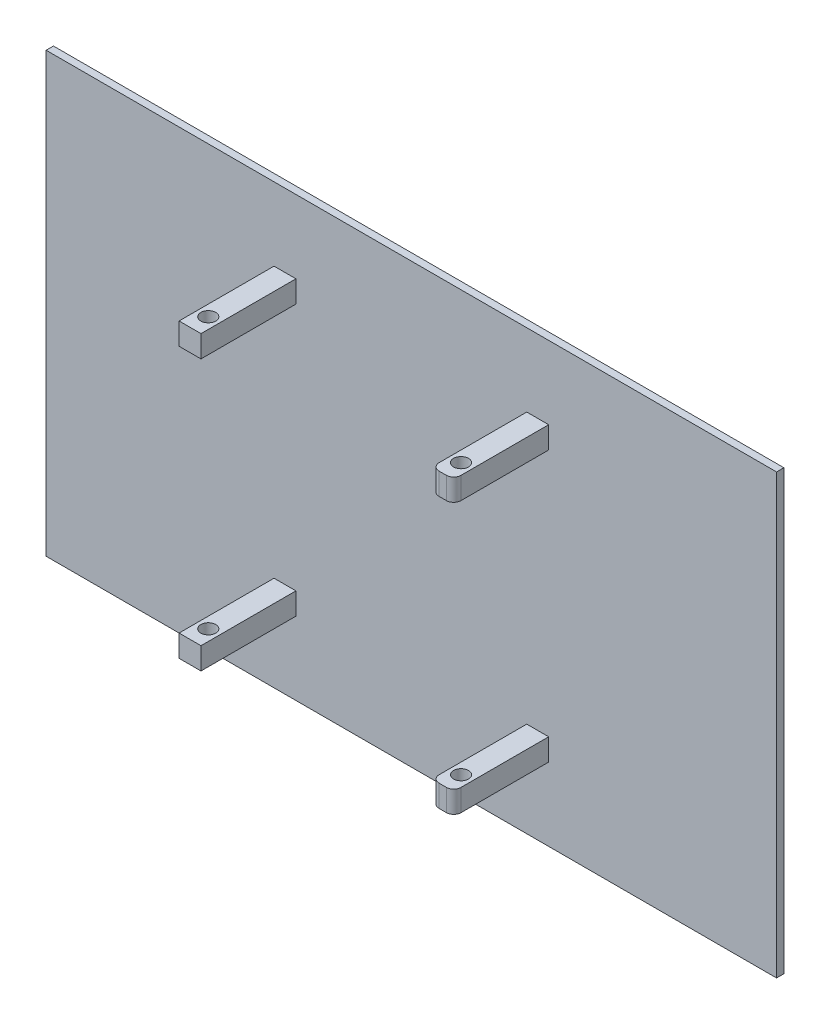
from build123d import *

# Parameters (mm, degrees)
ESBO_O1_W                  = 100
ESBO_O1_H                  = 60
RESSALTO_EXTRUS_O1_DEPTH   = 1
ESBO_O2_W                  = 3
ESBO_O2_H                  = 3
RESSALTO_EXTRUS_O2_DEPTH   = 14
CORTE_EXTRUS_O1_DEPTH      = 73.083285164
CORTE_EXTRUS_O1_DEPTH_BACK = 73.083285164
ESBO_O3_R                  = 1.025
FILETE1_R                  = 1
FILETE2_R                  = 1


with BuildPart() as part:
    # Esboço1 → Ressalto-extrusão1 (new body)
    with BuildSketch(Plane.XY):
        Rectangle(ESBO_O1_W, ESBO_O1_H)
    extrude(amount=RESSALTO_EXTRUS_O1_DEPTH)

    # Esboço2 → Ressalto-extrusão2 (add)
    with BuildSketch(Plane.XY):
        with Locations((17.3, 18.5)):
            Rectangle(ESBO_O2_W, ESBO_O2_H)
        with Locations((17.3, -18.5)):
            Rectangle(ESBO_O2_W, ESBO_O2_H)
        with Locations((-17.3, -18.5)):
            Rectangle(ESBO_O2_W, ESBO_O2_H)
        with Locations((-17.3, 18.5)):
            Rectangle(ESBO_O2_W, ESBO_O2_H)
    extrude(amount=RESSALTO_EXTRUS_O2_DEPTH)

    # Esboço3 → Corte-extrusão1 (cut, two sides: drawn at the far end of the back side and taken through both)
    with BuildSketch(Plane(origin=(0, -20, 0), x_dir=(-1, 0, 0), z_dir=(0, -1, 0)).offset(-CORTE_EXTRUS_O1_DEPTH_BACK)):
        with Locations(Location((-17.3, -11.5, 0), (0, 0, 90))):
            Circle(ESBO_O3_R)
        with Locations(Location((17.3, -11.5, 0), (0, 0, 90))):
            Circle(ESBO_O3_R)
    extrude(amount=CORTE_EXTRUS_O1_DEPTH + CORTE_EXTRUS_O1_DEPTH_BACK, mode=Mode.SUBTRACT)

    # Filete1
    filete1_edges = [part.edges().sort_by_distance(p)[0] for p in [
        (15.8, -18.5, 14),
    ]]
    fillet(filete1_edges, radius=FILETE1_R)

    # Filete2
    filete2_edges = [part.edges().sort_by_distance(p)[0] for p in [
        (18.8, 18.5, 14),
        (15.8, 18.5, 14),
        (18.8, -18.5, 14),
    ]]
    fillet(filete2_edges, radius=FILETE2_R)


solid = part.part
